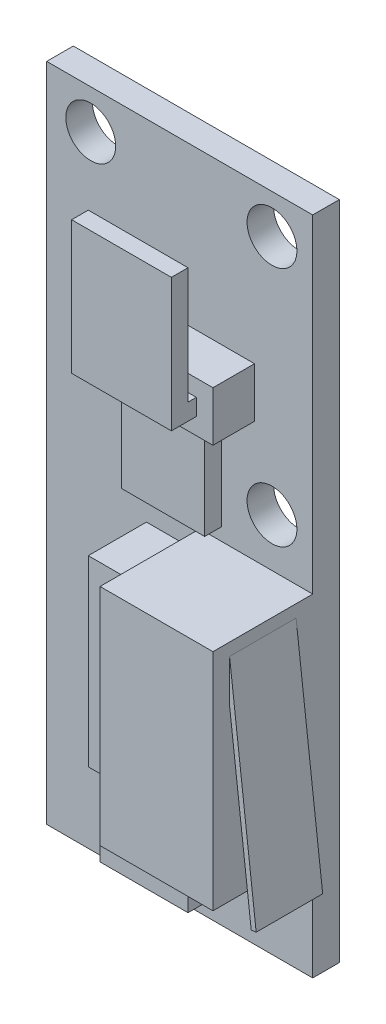
from build123d import *

# Parameters (mm, degrees)
CROQUIS3_W              = 16
CROQUIS3_H              = 39.75
SALIENTE_EXTRUIR1_DEPTH = 1.6
CROQUIS4_W              = 5
CROQUIS4_H              = 5.5
CROQUIS4_W_2            = 5.3
CROQUIS4_H_2            = 5.3
SALIENTE_EXTRUIR2_DEPTH = 1
CROQUIS5_W              = 6.792082101
CROQUIS5_H              = 13.5
SALIENTE_EXTRUIR3_DEPTH = 6
CROQUIS6_W              = 3.207917899
CROQUIS6_H              = 11
SALIENTE_EXTRUIR4_DEPTH = 3.5
CROQUIS7_W              = 8
CROQUIS7_H              = 3
SALIENTE_EXTRUIR5_DEPTH = 2.5
SALIENTE_EXTRUIR6_DEPTH = 3
CROQUIS9_R              = 1.5
CORTAR_EXTRUIR1_DEPTH   = 23.248946604
SALIENTE_EXTRUIR7_DEPTH = 2
CROQUIS11_W             = 7
CROQUIS11_H             = 4
CROQUIS11_W_2           = 4
CROQUIS11_H_2           = 12
SALIENTE_EXTRUIR8_DEPTH = 1.5


with BuildPart() as part:
    # Croquis3 → Saliente-Extruir1 (new body)
    with BuildSketch(Plane.XY):
        Rectangle(CROQUIS3_W, CROQUIS3_H)
    extrude(amount=SALIENTE_EXTRUIR1_DEPTH)

    # Croquis4 → Saliente-Extruir2 (add)
    with BuildSketch(Plane.XY.offset(1.6)):
        with Locations((0, 3.625)):
            Rectangle(CROQUIS4_W, CROQUIS4_H)
        with Locations((-1.15, -16.575)):
            Rectangle(CROQUIS4_W_2, CROQUIS4_H_2)
    extrude(amount=SALIENTE_EXTRUIR2_DEPTH)

    # Croquis5 → Saliente-Extruir3 (add)
    with BuildSketch(Plane.XY.offset(1.6)):
        with Locations((4.603958949, -6.625)):
            Rectangle(CROQUIS5_W, CROQUIS5_H)
    extrude(amount=SALIENTE_EXTRUIR3_DEPTH)

    # Croquis6 → Saliente-Extruir4 (add)
    with BuildSketch(Plane.XY.offset(1.6)):
        with Locations((-0.39604105, -6.625)):
            Rectangle(CROQUIS6_W, CROQUIS6_H)
    extrude(amount=SALIENTE_EXTRUIR4_DEPTH)

    # Croquis7 → Saliente-Extruir5 (add)
    with BuildSketch(Plane.XY.offset(1.6)):
        with Locations((0.5, 8.875)):
            Rectangle(CROQUIS7_W, CROQUIS7_H)
    extrude(amount=SALIENTE_EXTRUIR5_DEPTH)

    # Croquis8 → Saliente-Extruir6 (add, symmetric)
    with BuildSketch(Plane.ZY.offset(-0.5)):
        Polygon((4.1, 9.375), (4.6, 9.375), (4.6, 16.375), (5.6, 16.375), (5.6, 8.375), (4.1, 8.375), align=None)
    extrude(amount=SALIENTE_EXTRUIR6_DEPTH, both=True)

    # Croquis9 → Cortar-Extruir1 (cut, through all)
    with BuildSketch(Plane.XY.offset(1.6)):
        with Locations((5.55, 17.525)):
            Circle(CROQUIS9_R)
        with Locations((-5.35, 17.525)):
            Circle(CROQUIS9_R)
        with Locations((5.55, 3.025)):
            Circle(CROQUIS9_R)
        with Locations((5.55, -15.925)):
            Circle(CROQUIS9_R)
    extrude(amount=-CORTAR_EXTRUIR1_DEPTH, mode=Mode.SUBTRACT)

    # Croquis10 → Saliente-Extruir7 (add, symmetric)
    with BuildSketch(Plane(origin=(8, -13.375, 4.6), x_dir=(-1, 0, 0), z_dir=(0, 0, -1))):
        Polygon((0, 12.75), (-1.6, -0.814858061), (-1.302065369, -0.85), (0, 10.188957451), align=None)
    extrude(amount=SALIENTE_EXTRUIR7_DEPTH, both=True)

    # Croquis11 → Saliente-Extruir8 (add)
    with BuildSketch(Plane(origin=(0, 0, 0), x_dir=(-1, 0, 0), z_dir=(0, 0, -1))):
        with Locations((0, 8.875)):
            Rectangle(CROQUIS11_W, CROQUIS11_H)
        with Locations((1, -6.625)):
            Rectangle(CROQUIS11_W_2, CROQUIS11_H_2)
    extrude(amount=SALIENTE_EXTRUIR8_DEPTH)


solid = part.part
